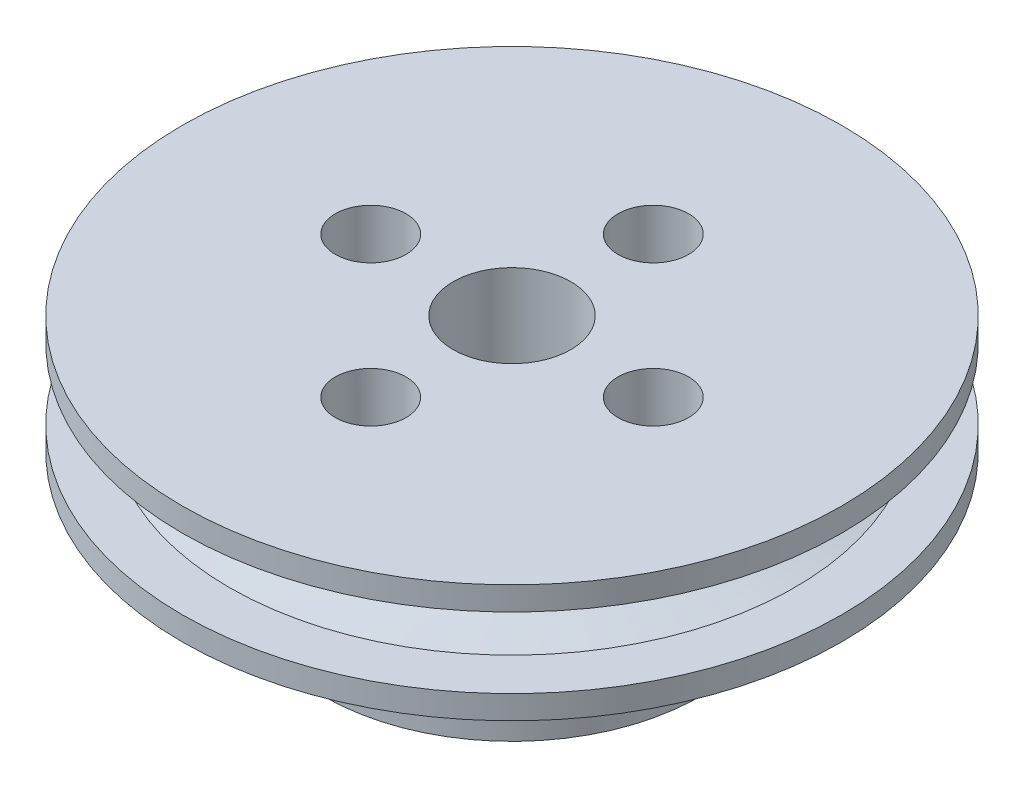
from build123d import *

# Parameters (mm, degrees)
SKETCH_1_R               = 8
EXTRUDE_1_DEPTH          = 5
SKETCH_4_R               = 1.5
CUT_EXTRUDE_1_DEPTH      = 5
SKETCH_5_R               = 1.05
CUT_EXTRUDE_2_DEPTH      = 5
CUT_EXTRUDE_3_DEPTH      = 20.697715725
CUT_EXTRUDE_3_DEPTH_BACK = 20.697715725
SKETCH_6_R               = 0.75
FILLET_1_R               = 2
SKETCH_7_R               = 2.5
CUT_EXTRUDE_4_DEPTH      = 18.691806177
SKETCH_8_W               = 2
SKETCH_8_H               = 1


with BuildPart() as part:
    # 草图1 → 凸台-拉伸1 (new body)
    with BuildSketch(Plane(origin=(0, 0, 0), x_dir=(1, 0, 0), z_dir=(0, 1, 0))):
        with Locations(Location((0, 0, 0), (0, 0, 270))):
            Circle(SKETCH_1_R)
    extrude(amount=EXTRUDE_1_DEPTH)

    # 草图3 → 旋转3 (revolve)
    with BuildSketch(Plane.XY, mode=Mode.PRIVATE) as revolve_3_sk:
        with BuildLine():
            Line((2.5, 5), (12, 5))
            Line((12, 5), (12, 6))
            add(Edge.make_bspline(
                [(12, 6), (11.881605513, 6.037686136), (11.643847391, 6.113366384), (11.1308123, 6.277999279), (10.853848161, 6.374268454), (10.462432208, 6.511227783), (10.343110433, 6.559604769), (10.19237694, 6.616697566), (10.135568567, 6.640570799), (10.044493212, 6.677585871), (9.943739799, 6.720706003), (9.809699725, 6.780371733), (9.648775717, 6.858112274), (9.471041518, 6.953541858), (9.30348757, 7.060847742), (9.170715349, 7.168533862), (9.081288373, 7.270836083), (9.034264055, 7.349098369), (9.00966007, 7.414359694), (8.999065655, 7.473026617), (8.999342857, 7.529783688), (9.010470802, 7.588482504), (9.035781555, 7.653997439), (9.08372319, 7.732478484), (9.154743932, 7.812639974), (9.243856794, 7.890764576), (9.36325959, 7.977520225), (9.480401778, 8.049948999), (9.59976532, 8.115407144), (9.725024816, 8.178944598), (9.843468468, 8.234393018), (9.962029893, 8.288066069), (10.093902347, 8.342284824), (10.180119226, 8.378587138), (10.347165548, 8.442047118), (10.468262515, 8.490865615), (10.857491167, 8.626989754), (11.133661478, 8.72292094), (11.645360185, 8.887115159), (11.882008148, 8.962442027), (12, 9)],
                knots=[0.083325581, 0.083325581, 0.083325581, 0.083325581, 0.083325581, 0.155200362, 0.227075164, 0.263012583, 0.298950001, 0.307934351, 0.316918701, 0.32590305, 0.3348874, 0.352856099, 0.370824799, 0.396081378, 0.421337957, 0.449866264, 0.4667317, 0.47810977, 0.48654791, 0.493647494, 0.50018096, 0.506692176, 0.513761649, 0.522297603, 0.533856047, 0.55081559, 0.565113209, 0.579410828, 0.604781909, 0.61746745, 0.63015299, 0.648060561, 0.665968131, 0.683875702, 0.692829487, 0.701783273, 0.737598478, 0.773413683, 0.845044069, 0.916674419, 0.916674419, 0.916674419, 0.916674419, 0.916674419], degree=4))
            Line((12, 9), (12, 10))
            Line((12, 10), (2.5, 10))
            Line((2.5, 10), (2.5, 5))
        make_face()
    revolve(revolve_3_sk.sketch.rotate(Axis((0, 11, 0), (0, -1, 0)), 90), axis=Axis((0, 11, 0), (0, -1, 0)))

    # 草图4 → 切除-拉伸1 (cut)
    with BuildSketch(Plane(origin=(0, 10, 0), x_dir=(1, 0, 0), z_dir=(0, 1, 0))):
        with Locations(Location((0, 6, 0), (0, 0, 180))):
            Circle(SKETCH_4_R)
        with Locations(Location((6, 0, 0), (0, 0, 180))):
            Circle(SKETCH_4_R)
        with Locations(Location((0, -6, 0), (0, 0, 180))):
            Circle(SKETCH_4_R)
        with Locations(Location((-6, 0, 0), (0, 0, 180))):
            Circle(SKETCH_4_R)
    extrude(amount=-CUT_EXTRUDE_1_DEPTH, mode=Mode.SUBTRACT)

    # 草图5 → 切除-拉伸2 (cut)
    with BuildSketch(Plane(origin=(0, 5, 0), x_dir=(1, 0, 0), z_dir=(0, 1, 0))):
        with Locations(Location((0, 6, 0), (0, 0, 180))):
            Circle(SKETCH_5_R)
        with Locations(Location((-6, 0, 0), (0, 0, 180))):
            Circle(SKETCH_5_R)
        with Locations(Location((6, 0, 0), (0, 0, 180))):
            Circle(SKETCH_5_R)
        with Locations(Location((0, -6, 0), (0, 0, 180))):
            Circle(SKETCH_5_R)
    extrude(amount=-CUT_EXTRUDE_2_DEPTH, mode=Mode.SUBTRACT)

    # 草图6 → 切除-拉伸3 (cut, two sides: drawn at the far end of the back side and taken through both)
    with BuildSketch(Plane(origin=(0, 0, 0), x_dir=(0, 0, -1), z_dir=(1, 0, 0)).offset(-CUT_EXTRUDE_3_DEPTH_BACK)):
        with Locations((-6, 7.5)):
            Circle(SKETCH_6_R)
    extrude(amount=CUT_EXTRUDE_3_DEPTH + CUT_EXTRUDE_3_DEPTH_BACK, mode=Mode.SUBTRACT)

    # 圆角1
    fillet_1_edges = [part.edges().sort_by_distance(p)[0] for p in [
        (0, 5, -8),
    ]]
    fillet(fillet_1_edges, radius=FILLET_1_R)

    # 草图7 → 切除-拉伸4 (cut, through all)
    with BuildSketch(Plane(origin=(0, 5, 0), x_dir=(1, 0, 0), z_dir=(0, 1, 0))):
        with Locations(Location((0, 0, 0), (0, 0, 270))):
            Circle(SKETCH_7_R)
    extrude(amount=-CUT_EXTRUDE_4_DEPTH, mode=Mode.SUBTRACT)

    # 草图8 → 旋转4 (revolve)
    with BuildSketch(Plane.XY, mode=Mode.PRIVATE) as revolve_4_sk:
        with Locations((13, 9.5)):
            Rectangle(SKETCH_8_W, SKETCH_8_H)
        with Locations((13, 5.5)):
            Rectangle(SKETCH_8_W, SKETCH_8_H)
    revolve(revolve_4_sk.sketch.rotate(Axis((0, 9, 0), (0, -1, 0)), 180), axis=Axis((0, 9, 0), (0, -1, 0)))


solid = part.part
